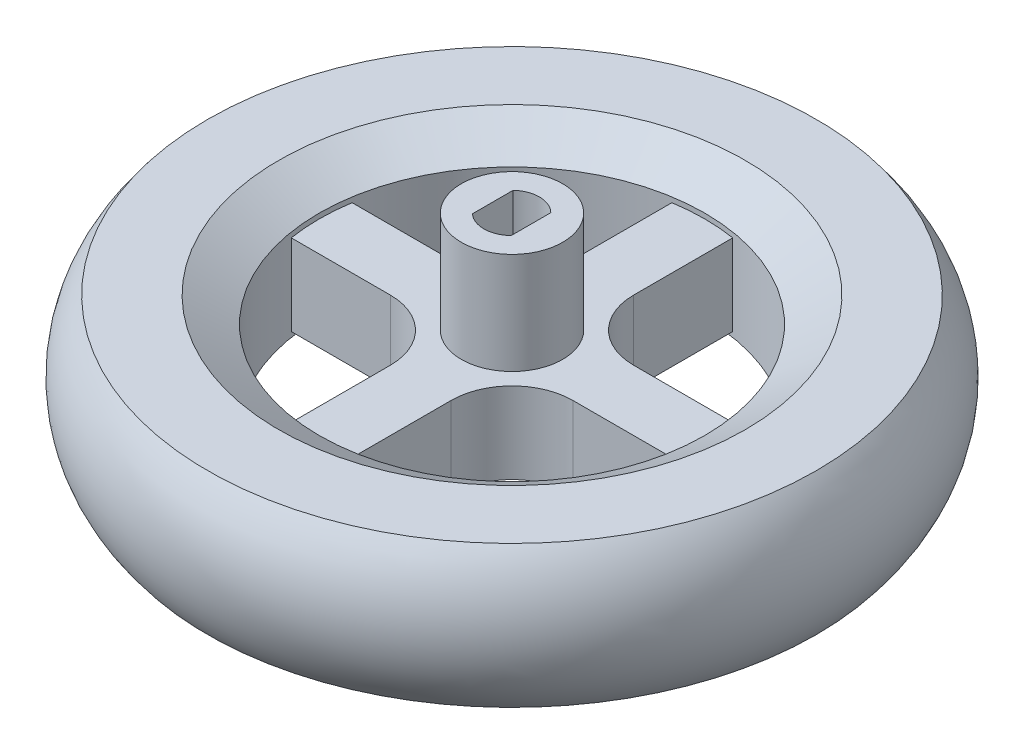
from build123d import *

# Parameters (mm, degrees)
BOSS_EXTRUDE1_DEPTH      = 4
BOSS_EXTRUDE1_DEPTH_BACK = 4
SKETCH4_R                = 5
BOSS_EXTRUDE2_DEPTH      = 10
CUT_EXTRUDE1_DEPTH       = 9


with BuildPart() as part:
    # Sketch2 → Revolve1 (revolve)
    with BuildSketch(Plane.XY, mode=Mode.PRIVATE) as revolve1_sk:
        with BuildLine():
            Line((-19, -4.5), (-19, 4.5))
            Line((-19, 4.5), (-23, 7))
            Line((-23, 7), (-30, 7))
            ThreePointArc((-30, 7), (-32.5, 0), (-30, -7))
            Line((-30, -7), (-23, -7))
            Line((-23, -7), (-19, -4.5))
        make_face()
    revolve(revolve1_sk.sketch.rotate(Axis((0, -7, 0), (0, 1, 0)), 180), axis=Axis((0, -7, 0), (0, 1, 0)))

    # Sketch3 → Boss-Extrude1 (add, two sides: drawn at the far end of the back side and taken through both)
    with BuildSketch(Plane(origin=(0, 0, 0), x_dir=(1, 0, 0), z_dir=(0, 1, 0)).offset(-BOSS_EXTRUDE1_DEPTH_BACK)):
        with BuildLine():
            Line((9, 3), (25, 3))
            Line((25, 3), (25, -3))
            Line((25, -3), (9, -3))
            ThreePointArc((9, -3), (4.757359313, -4.757359313), (3, -9))
            Line((3, -9), (3, -25))
            Line((3, -25), (-3, -25))
            Line((-3, -25), (-3, -9))
            ThreePointArc((-3, -9), (-4.757359313, -4.757359313), (-9, -3))
            Line((-9, -3), (-25, -3))
            Line((-25, -3), (-25, 3))
            Line((-25, 3), (-9, 3))
            ThreePointArc((-9, 3), (-4.757359313, 4.757359313), (-3, 9))
            Line((-3, 9), (-3, 25))
            Line((-3, 25), (3, 25))
            Line((3, 25), (3, 9))
            ThreePointArc((3, 9), (4.757359313, 4.757359313), (9, 3))
        make_face()
    extrude(amount=BOSS_EXTRUDE1_DEPTH + BOSS_EXTRUDE1_DEPTH_BACK)

    # Sketch4 → Boss-Extrude2 (add)
    with BuildSketch(Plane(origin=(0, 4, 0), x_dir=(1, 0, 0), z_dir=(0, 1, 0))):
        with Locations(Location((0, 0, 0), (0, 0, 180))):
            Circle(SKETCH4_R)
    extrude(amount=BOSS_EXTRUDE2_DEPTH)

    # Sketch5 → Cut-Extrude1 (cut)
    with BuildSketch(Plane(origin=(0, 14, 0), x_dir=(1, 0, 0), z_dir=(0, 1, 0))):
        with BuildLine():
            Line((-1.885, -2.017231601), (-1.885, 2.002198265))
            ThreePointArc((-1.885, 2.002198265), (0.011383629, 2.727171226), (1.885, 1.945238778))
            Line((1.885, 1.945238778), (1.885, -1.960272114))
            ThreePointArc((1.885, -1.960272114), (0.011383629, -2.742204562), (-1.885, -2.017231601))
        make_face()
    extrude(amount=-CUT_EXTRUDE1_DEPTH, mode=Mode.SUBTRACT)


solid = part.part
